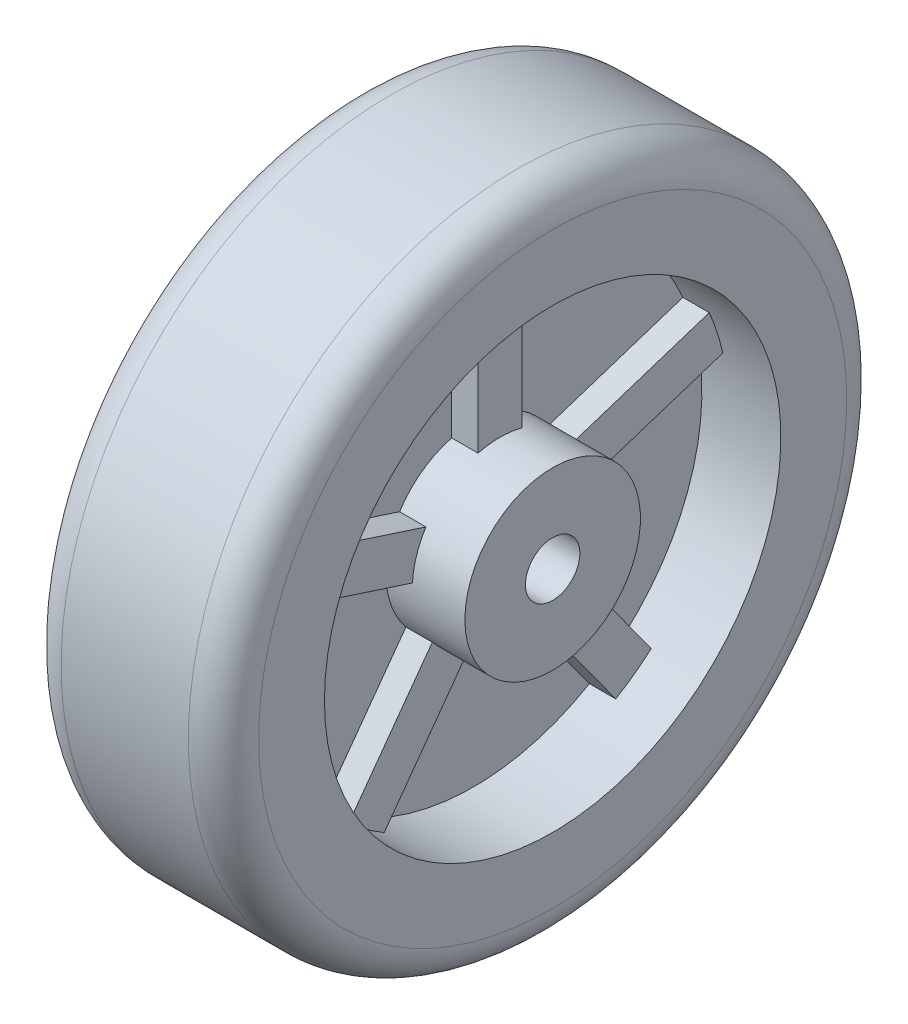
from build123d import *

# Parameters (mm, degrees)
SKETCH_1_R               = 60
EXTRUDE_1_DEPTH          = 22.5
SKETCH_2_R               = 75
SKETCH_2_R_2             = 60
EXTRUDE_2_DEPTH          = 45
FILLET_1_R               = 8
SKETCH_3_R               = 52
SKETCH_3_R_2             = 20
CUT_EXTRUDE_1_DEPTH      = 18
SKETCH_4_R               = 6.2
CUT_EXTRUDE_2_DEPTH      = 116.217186348
EXTRUDE_START            = 6
EXTRUDE_3_DEPTH          = 6
PATTERN_CIRCULAR_1_COUNT = 5
MIRROR_START             = 6
MIRROR_2_COPY_1_DEPTH    = 6
MIRROR_2_COPY_2_DEPTH    = 6
MIRROR_2_COPY_3_DEPTH    = 6
MIRROR_2_COPY_4_DEPTH    = 6


with BuildPart() as part:
    # 草图1 → 凸台-拉伸1 (new, symmetric)
    with BuildSketch(Plane(origin=(0, 0, 0), x_dir=(0, 0, -1), z_dir=(1, 0, 0))):
        with Locations(Location((0, 0, 0), (0, 0, 180))):
            Circle(SKETCH_1_R)
    extrude(amount=EXTRUDE_1_DEPTH, both=True)

    # 草图3 → 切除-拉伸1 (cut)
    with BuildSketch(Plane.ZY.offset(22.5)):
        Circle(SKETCH_3_R)
        Circle(SKETCH_3_R_2, mode=Mode.SUBTRACT)
    cut_extrude_1 = extrude(amount=-CUT_EXTRUDE_1_DEPTH, mode=Mode.SUBTRACT)

    # 草图4 → 切除-拉伸2 (cut, through all)
    with BuildSketch(Plane.ZY.offset(22.5)):
        Circle(SKETCH_4_R)
    extrude(amount=-CUT_EXTRUDE_2_DEPTH, mode=Mode.SUBTRACT)


with BuildPart() as body_2:
    # 草图2 → 凸台-拉伸2 (new body)
    with BuildSketch(Plane(origin=(22.5, 0, 0), x_dir=(0, 0, -1), z_dir=(1, 0, 0))):
        Circle(SKETCH_2_R)
        Circle(SKETCH_2_R_2, mode=Mode.SUBTRACT)
    extrude(amount=-EXTRUDE_2_DEPTH)

    # 圆角1
    fillet_1_edges = [body_2.edges().sort_by_distance(p)[0] for p in [
        (22.5, 0, 75),
        (-22.5, 0, 75),
    ]]
    fillet(fillet_1_edges, radius=FILLET_1_R)


    add(part.part)  # 凸台-拉伸3 merges part
    # 草图5 → 凸台-拉伸3 (add)
    with BuildSketch(Plane.ZY.offset(4.5).offset(EXTRUDE_START)):
        with BuildLine():
            ThreePointArc((5, 51.759057178), (0, 52), (-5, 51.759057178))
            Line((-5, 51.759057178), (-5, 19.364916731))
            ThreePointArc((-5, 19.364916731), (0, 20), (5, 19.364916731))
            Line((5, 19.364916731), (5, 51.759057178))
        make_face()
    extrude_3 = extrude(amount=-EXTRUDE_3_DEPTH)

    # 阵列(圆周)1: 凸台-拉伸3 ×5 about axis
    pattern_circular_1_axis = Axis((0, 0, 0), (1, 0, 0))
    for i in range(1, PATTERN_CIRCULAR_1_COUNT):
        add(extrude_3.rotate(pattern_circular_1_axis, i * 360 / PATTERN_CIRCULAR_1_COUNT))

    # 镜向2: 切除-拉伸1, 凸台-拉伸3 across plane
    add(cut_extrude_1.mirror(Plane(origin=(0, 0, 0), x_dir=(0, 0, 1), z_dir=(1, 0, 0))), mode=Mode.SUBTRACT)
    add(extrude_3.mirror(Plane(origin=(0, 0, 0), x_dir=(0, 0, 1), z_dir=(1, 0, 0))))

    # 镜向2 copy 1 sketch → 镜向2 copy 1 (add)
    with BuildSketch(Plane(origin=(4.5, 0, 0), x_dir=(0, -0.9510565162951535, 0.30901699437494745), z_dir=(1, 0, 0)).offset(MIRROR_START)):
        with BuildLine():
            ThreePointArc((5, -51.759057178), (0, -52), (-5, -51.759057178))
            Line((-5, -51.759057178), (-5, -19.364916731))
            ThreePointArc((-5, -19.364916731), (0, -20), (5, -19.364916731))
            Line((5, -19.364916731), (5, -51.759057178))
        make_face()
    extrude(amount=-MIRROR_2_COPY_1_DEPTH)

    # 镜向2 copy 2 sketch → 镜向2 copy 2 (add)
    with BuildSketch(Plane(origin=(4.5, 0, 0), x_dir=(0, -0.5877852522924732, -0.8090169943749473), z_dir=(1, 0, 0)).offset(MIRROR_START)):
        with BuildLine():
            ThreePointArc((5, -51.759057178), (0, -52), (-5, -51.759057178))
            Line((-5, -51.759057178), (-5, -19.364916731))
            ThreePointArc((-5, -19.364916731), (0, -20), (5, -19.364916731))
            Line((5, -19.364916731), (5, -51.759057178))
        make_face()
    extrude(amount=-MIRROR_2_COPY_2_DEPTH)

    # 镜向2 copy 3 sketch → 镜向2 copy 3 (add)
    with BuildSketch(Plane(origin=(4.5, 0, 0), x_dir=(0, 0.587785252292473, -0.8090169943749476), z_dir=(1, 0, 0)).offset(MIRROR_START)):
        with BuildLine():
            ThreePointArc((5, -51.759057178), (0, -52), (-5, -51.759057178))
            Line((-5, -51.759057178), (-5, -19.364916731))
            ThreePointArc((-5, -19.364916731), (0, -20), (5, -19.364916731))
            Line((5, -19.364916731), (5, -51.759057178))
        make_face()
    extrude(amount=-MIRROR_2_COPY_3_DEPTH)

    # 镜向2 copy 4 sketch → 镜向2 copy 4 (add)
    with BuildSketch(Plane(origin=(4.5, 0, 0), x_dir=(0, 0.9510565162951536, 0.30901699437494723), z_dir=(1, 0, 0)).offset(MIRROR_START)):
        with BuildLine():
            ThreePointArc((5, -51.759057178), (0, -52), (-5, -51.759057178))
            Line((-5, -51.759057178), (-5, -19.364916731))
            ThreePointArc((-5, -19.364916731), (0, -20), (5, -19.364916731))
            Line((5, -19.364916731), (5, -51.759057178))
        make_face()
    extrude(amount=-MIRROR_2_COPY_4_DEPTH)


solid = body_2.part
